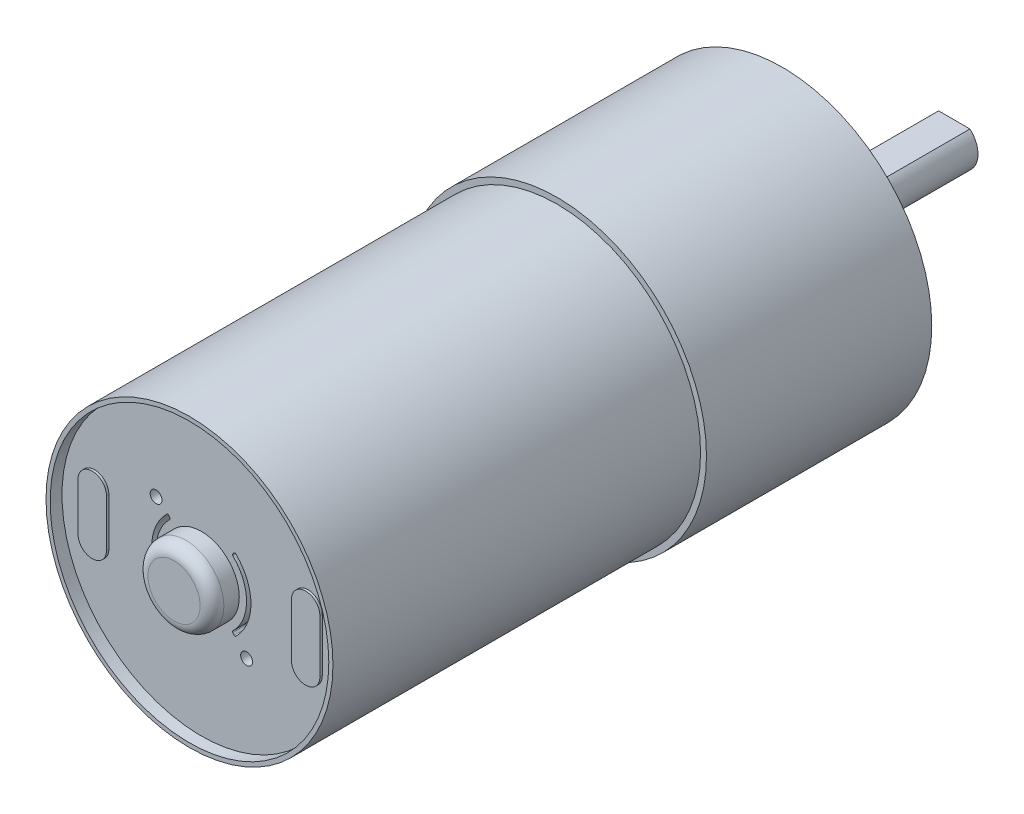
from build123d import *

# Parameters (mm, degrees)
SKETCH1_R           = 12.6
BOSS_EXTRUDE1_DEPTH = 19
SKETCH2_R           = 12.1
BOSS_EXTRUDE2_DEPTH = 30
SKETCH3_R           = 12.1
SKETCH3_R_2         = 11.75
BOSS_EXTRUDE3_DEPTH = 1
SKETCH4_R           = 3.2
BOSS_EXTRUDE4_DEPTH = 2.3
FILLET1_R           = 1
BOSS_EXTRUDE5_DEPTH = 0.2
SKETCH6_R           = 0.5
CUT_EXTRUDE1_DEPTH  = 20
CUT_EXTRUDE2_DEPTH  = 0.1
CIRPATTERN1_COUNT   = 4
SKETCH8_R           = 3.5
BOSS_EXTRUDE6_DEPTH = 2.5
SKETCH9_R           = 2
BOSS_EXTRUDE7_DEPTH = 12
CUT_EXTRUDE3_START  = -10
CUT_EXTRUDE3_DEPTH  = 10
SKETCH11_R          = 1.5
CUT_EXTRUDE4_DEPTH  = 10


with BuildPart() as part:
    # Sketch1 → Boss-Extrude1 (new body)
    with BuildSketch(Plane.XY):
        Circle(SKETCH1_R)
    extrude(amount=BOSS_EXTRUDE1_DEPTH)

    # Sketch2 → Boss-Extrude2 (add)
    with BuildSketch(Plane.XY.offset(19)):
        Circle(SKETCH2_R)
    extrude(amount=BOSS_EXTRUDE2_DEPTH)

    # Sketch3 → Boss-Extrude3 (add)
    with BuildSketch(Plane.XY.offset(49)):
        Circle(SKETCH3_R)
        Circle(SKETCH3_R_2, mode=Mode.SUBTRACT)
    extrude(amount=BOSS_EXTRUDE3_DEPTH)

    # Sketch4 → Boss-Extrude4 (add)
    with BuildSketch(Plane.XY.offset(49)):
        Circle(SKETCH4_R)
    extrude(amount=BOSS_EXTRUDE4_DEPTH)

    # Fillet1
    fillet1_edges = [part.edges().sort_by_distance(p)[0] for p in [
        (-3.2, 0, 51.3),
    ]]
    fillet(fillet1_edges, radius=FILLET1_R)

    # Sketch5 → Boss-Extrude5 (add)
    with BuildSketch(Plane.XY.offset(49)):
        with BuildLine():
            Line((-7.8, 2), (-7.8, -2))
            ThreePointArc((-7.8, -2), (-9, -3.2), (-10.2, -2))
            Line((-10.2, -2), (-10.2, 2))
            ThreePointArc((-10.2, 2), (-9, 3.2), (-7.8, 2))
        make_face()
        with BuildLine():
            Line((10.2, 2.236300976), (10.2, -2.236300976))
            ThreePointArc((10.2, -2.236300976), (9, -3.436300976), (7.8, -2.236300976))
            Line((7.8, -2.236300976), (7.8, 2.236300976))
            ThreePointArc((7.8, 2.236300976), (9, 3.436300976), (10.2, 2.236300976))
        make_face()
    extrude(amount=BOSS_EXTRUDE5_DEPTH)

    # Sketch6 → Cut-Extrude1 (cut)
    with BuildSketch(Plane.XY.offset(49)):
        with Locations((-3.815326444, 3.815326444)):
            Circle(SKETCH6_R)
        with Locations((3.815326444, -4.184114524)):
            Circle(SKETCH6_R)
        with BuildLine():
            Line((-2.763844704, 3.00518783), (-2.64955067, 2.880913468))
            ThreePointArc((-2.64955067, 2.880913468), (-2.623197255, 2.81031672), (-2.653603933, 2.741368644))
            ThreePointArc((-2.653603933, 2.741368644), (-3.815326444, 0), (-2.653603933, -2.741368644))
            ThreePointArc((-2.653603933, -2.741368644), (-2.623197255, -2.81031672), (-2.64955067, -2.880913468))
            Line((-2.64955067, -2.880913468), (-2.763844704, -3.00518783))
            ThreePointArc((-2.763844704, -3.00518783), (-2.834492952, -3.037450785), (-2.906924389, -3.00941937))
            ThreePointArc((-2.906924389, -3.00941937), (-4.184114524, 0), (-2.906924389, 3.00941937))
            ThreePointArc((-2.906924389, 3.00941937), (-2.834492952, 3.037450785), (-2.763844704, 3.00518783))
        make_face()
        with BuildLine():
            Line((2.64955067, 2.880913468), (2.763844704, 3.00518783))
            ThreePointArc((2.763844704, 3.00518783), (2.834492952, 3.037450785), (2.906924389, 3.00941937))
            ThreePointArc((2.906924389, 3.00941937), (4.184114524, 0), (2.906924389, -3.00941937))
            ThreePointArc((2.906924389, -3.00941937), (2.834492952, -3.037450785), (2.763844704, -3.00518783))
            Line((2.763844704, -3.00518783), (2.64955067, -2.880913468))
            ThreePointArc((2.64955067, -2.880913468), (2.623197255, -2.81031672), (2.653603933, -2.741368644))
            ThreePointArc((2.653603933, -2.741368644), (3.815326444, 0), (2.653603933, 2.741368644))
            ThreePointArc((2.653603933, 2.741368644), (2.623197255, 2.81031672), (2.64955067, 2.880913468))
        make_face()
    extrude(amount=-CUT_EXTRUDE1_DEPTH, mode=Mode.SUBTRACT)

    # Sketch7 → Cut-Extrude2 (cut)
    with BuildSketch(Plane(origin=(0, 0, 0), x_dir=(-1, 0, 0), z_dir=(0, 0, -1))):
        with BuildLine():
            Line((4, 10.246950766), (1.709090909, 4.3782426))
            ThreePointArc((1.709090909, 4.3782426), (3.323401872, 3.323401872), (4.3782426, 1.709090909))
            Line((4.3782426, 1.709090909), (10.246950766, 4))
            ThreePointArc((10.246950766, 4), (7.778174593, 7.778174593), (4, 10.246950766))
        make_face()
    cut_extrude2 = extrude(amount=-CUT_EXTRUDE2_DEPTH, mode=Mode.SUBTRACT)

    # CirPattern1: Cut-Extrude2 ×4 about axis
    cirpattern1_axis = Axis((0, 0, 0), (0, 0, 1))
    for i in range(1, CIRPATTERN1_COUNT):
        add(cut_extrude2.rotate(cirpattern1_axis, i * 360 / CIRPATTERN1_COUNT), mode=Mode.SUBTRACT)

    # Sketch8 → Boss-Extrude6 (add)
    with BuildSketch(Plane(origin=(0, 0, 0), x_dir=(-1, 0, 0), z_dir=(0, 0, -1))):
        Circle(SKETCH8_R)
    extrude(amount=BOSS_EXTRUDE6_DEPTH)

    # Sketch9 → Boss-Extrude7 (add)
    with BuildSketch(Plane(origin=(0, 0, -2.5), x_dir=(-1, 0, 0), z_dir=(0, 0, -1))):
        Circle(SKETCH9_R)
    extrude(amount=BOSS_EXTRUDE7_DEPTH)

    # Sketch10 → Cut-Extrude3 (cut)
    with BuildSketch(Plane(origin=(0, 0, -14.5), x_dir=(-1, 0, 0), z_dir=(0, 0, -1)).offset(CUT_EXTRUDE3_START)):
        with BuildLine():
            Line((-1.322875656, 1.5), (1.322875656, 1.5))
            ThreePointArc((1.322875656, 1.5), (0, 2), (-1.322875656, 1.5))
        make_face()
    extrude(amount=CUT_EXTRUDE3_DEPTH, mode=Mode.SUBTRACT)

    # Sketch11 → Cut-Extrude4 (cut)
    with BuildSketch(Plane(origin=(0, 0, 0), x_dir=(-1, 0, 0), z_dir=(0, 0, -1))):
        with Locations((-8.5, 0)):
            Circle(SKETCH11_R)
        with Locations((8.5, 0)):
            Circle(SKETCH11_R)
    extrude(amount=-CUT_EXTRUDE4_DEPTH, mode=Mode.SUBTRACT)


solid = part.part
